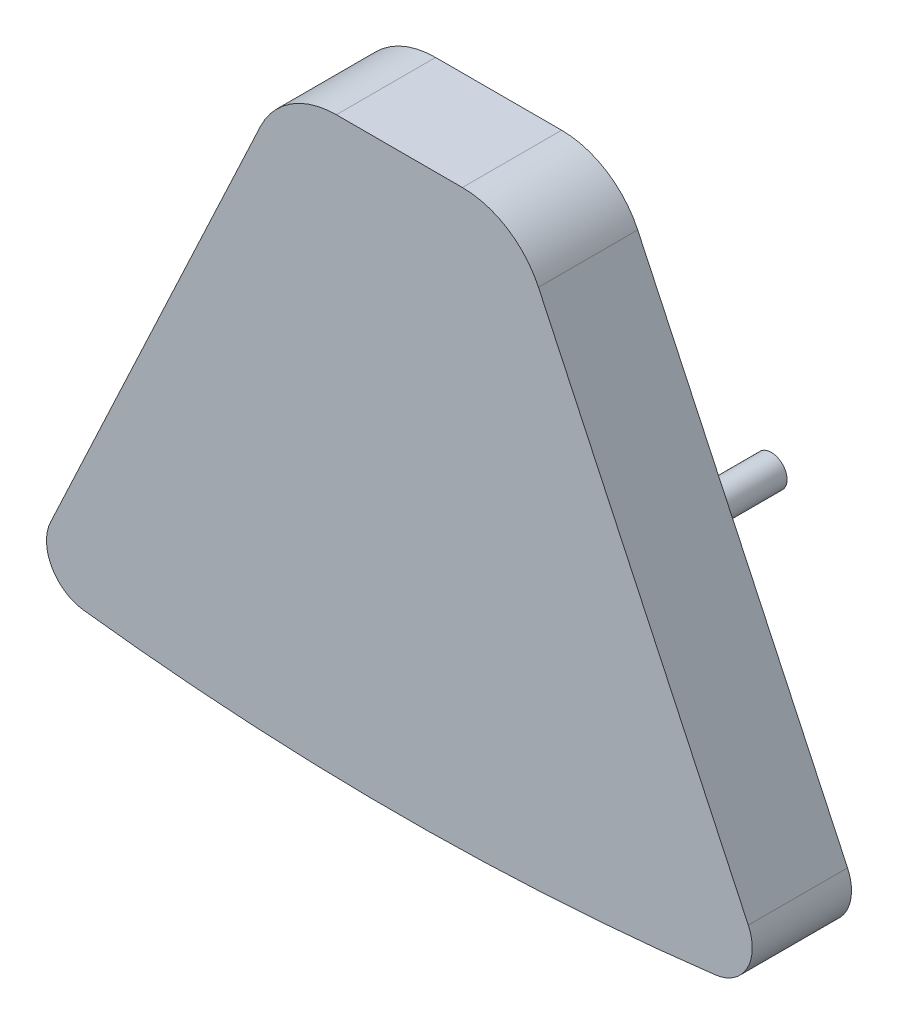
from build123d import *

# Parameters (mm, degrees)
BOSS_EXTRUDE1_DEPTH = 15
SKETCH2_R           = 2.38125
BOSS_EXTRUDE2_DEPTH = 13.716


with BuildPart() as part:
    # Sketch1 → Boss-Extrude1 (new body)
    with BuildSketch(Plane.XY):
        with BuildLine():
            Line((-52.739408914, 11.9161458), (-21.023817827, 79.5593995))
            ThreePointArc((-21.023817827, 79.5593995), (-16.337460141, 84.886226851), (-9.525, 86.868))
            Line((-9.525, 86.868), (9.525, 86.868))
            ThreePointArc((9.525, 86.868), (16.337460141, 84.886226851), (21.023817827, 79.5593995))
            Line((21.023817827, 79.5593995), (52.739408914, 11.9161458))
            ThreePointArc((52.739408914, 11.9161458), (52.54682937, 6.1473129), (47.762912079, 2.917660402))
            ThreePointArc((47.762912079, 2.917660402), (0, 0), (-47.762912079, 2.917660402))
            ThreePointArc((-47.762912079, 2.917660402), (-52.54682937, 6.1473129), (-52.739408914, 11.9161458))
        make_face()
    extrude(amount=BOSS_EXTRUDE1_DEPTH)

    # Sketch2 → Boss-Extrude2 (add)
    with BuildSketch(Plane(origin=(0, 0, 0), x_dir=(-1, 0, 0), z_dir=(0, 0, -1))):
        with Locations((-27.5, 44.45)):
            Circle(SKETCH2_R)
        with Locations((27.5, 44.45)):
            Circle(SKETCH2_R)
    extrude(amount=BOSS_EXTRUDE2_DEPTH)


solid = part.part
